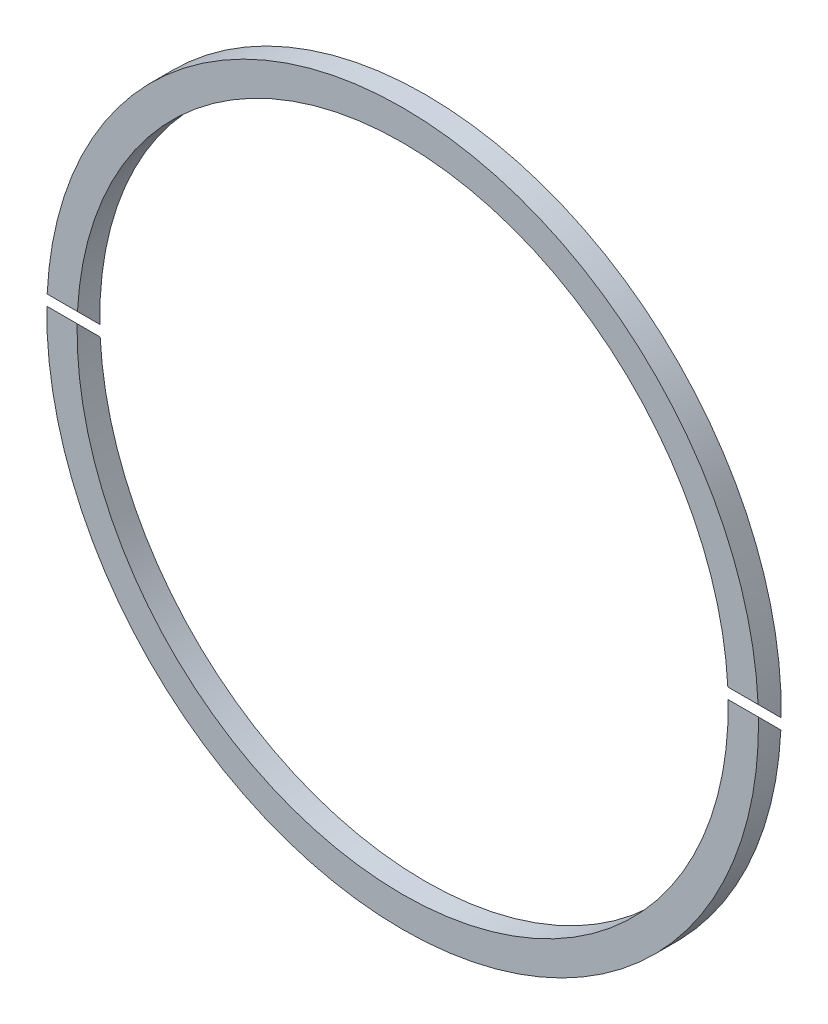
from build123d import *

# Parameters (mm, degrees)
SKETCH1_R               = 47
SKETCH1_R_2             = 43
BOSS_EXTRUDE1_DEPTH     = 1.5
CUT_EXTRUDE2_DEPTH      = 67.484960705
CUT_EXTRUDE2_DEPTH_BACK = 67.484960705


with BuildPart() as part:
    # Sketch1 → Boss-Extrude1 (new, symmetric)
    with BuildSketch(Plane.XY):
        Circle(SKETCH1_R)
        Circle(SKETCH1_R_2, mode=Mode.SUBTRACT)
    extrude(amount=BOSS_EXTRUDE1_DEPTH, both=True)

    # Sketch2 → Cut-Extrude2 (cut, two sides: drawn at the far end of the back side and taken through both)
    with BuildSketch(Plane(origin=(0, 0, 0), x_dir=(0, 0, -1), z_dir=(1, 0, 0)).offset(-CUT_EXTRUDE2_DEPTH_BACK)):
        Polygon((-4.065273559, 3.358166778), (5.813590619, -6.5206974), (6.5206974, -5.813590619), (-3.358166778, 4.065273559), align=None)
    extrude(amount=CUT_EXTRUDE2_DEPTH + CUT_EXTRUDE2_DEPTH_BACK, mode=Mode.SUBTRACT)


with BuildPart() as cut_extrude2_piece_1:
    # of the separate pieces the step leaves, piece 1, a body of its own (cut_extrude2_pieces)
    add(part.part.solids().sort_by_distance((46.993311443, 0.792893219, 1.5))[0])


with BuildPart() as cut_extrude2_piece_2:
    # of the separate pieces the step leaves, piece 2, a body of its own (cut_extrude2_pieces)
    add(part.part.solids().sort_by_distance((47, 0, -0.707106781))[0])


solid = Compound([cut_extrude2_piece_1.part, cut_extrude2_piece_2.part])
